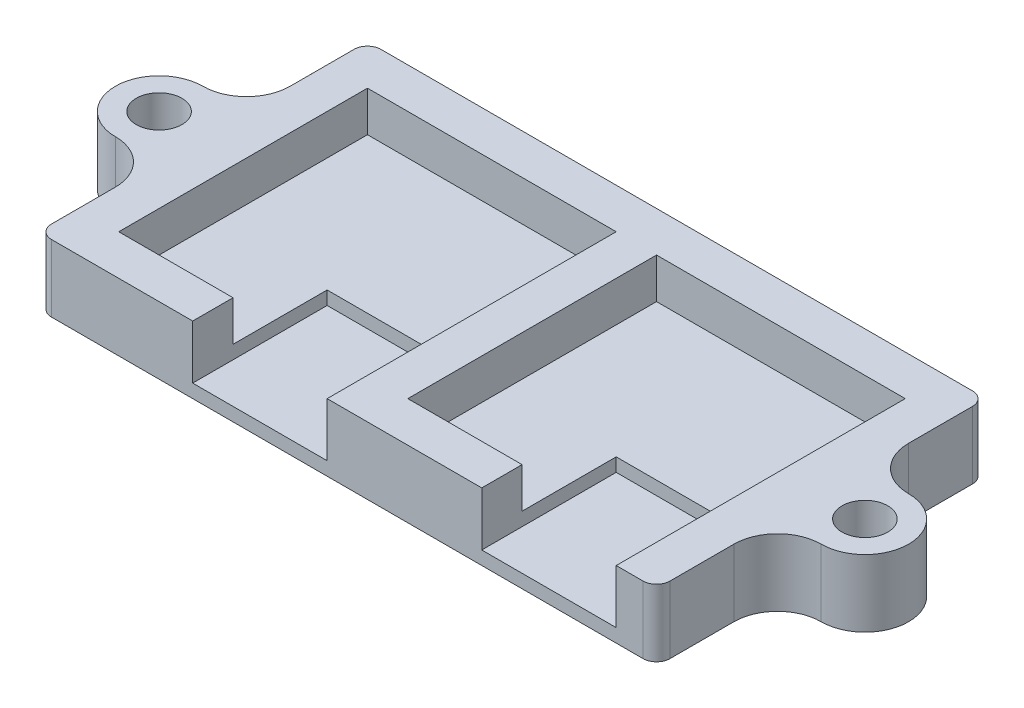
from build123d import *

# Parameters (mm, degrees)
SKETCH_1_R      = 1.7
SKETCH_1_W      = 10
SKETCH_1_H      = 3
SKETCH_1_H_2    = 7
EXTRUDE_1_DEPTH = 1
EXTRUDE_START   = 1
SKETCH_1_3_R    = 1.7
EXTRUDE_2_DEPTH = 1
EXTRUDE_START_2 = 2
SKETCH_1_5_R    = 1.7
EXTRUDE_3_DEPTH = 3
EXTRUDE_START_3 = 7
SKETCH_1_7_R    = 1.7
SKETCH_1_7_W    = 10
SKETCH_1_7_H    = 3
EXTRUDE_4_DEPTH = 2.5
EXTRUDE_START_4 = 9.5
SKETCH_1_9_W    = 10
SKETCH_1_9_H    = 7
SKETCH_1_9_H_2  = 3
SKETCH_1_9_R    = 1.7
EXTRUDE_5_DEPTH = 1
FILLET_1_R      = 1


with BuildPart() as part:
    # Эскиз1 → Бобышка-Вытянуть1 (new body)
    # profile 1 of 9: a face of its own
    with BuildSketch(Plane(origin=(0, 0, 0), x_dir=(1, 0, 0), z_dir=(0, 1, 0))):
        with BuildLine():
            ThreePointArc((-26.25, -3.25), (-23.951902961, -4.201902961), (-23, -6.5))
            Line((-23, -6.5), (-23, 6.5))
            ThreePointArc((-23, 6.5), (-23.951902961, 4.201902961), (-26.25, 3.25))
            ThreePointArc((-26.25, 3.25), (-29.5, 0), (-26.25, -3.25))
        make_face()
        with Locations(Location((-26.25, 0, 0), (0, 0, 270))):
            Circle(SKETCH_1_R, mode=Mode.SUBTRACT)
    # profile 2 of 9: a face of its own
    with BuildSketch(Plane(origin=(0, 0, 0), x_dir=(1, 0, 0), z_dir=(0, 1, 0))):
        with BuildLine():
            Line((20, -12.25), (22, -12.25))
            ThreePointArc((22, -12.25), (22.707106781, -11.957106781), (23, -11.25))
            Line((23, -11.25), (23, -6.5))
            Line((23, -6.5), (23, 6.5))
            Line((23, 6.5), (23, 11.25))
            ThreePointArc((23, 11.25), (22.707106781, 11.957106781), (22, 12.25))
            Line((22, 12.25), (-22, 12.25))
            ThreePointArc((-22, 12.25), (-22.707106781, 11.957106781), (-23, 11.25))
            Line((-23, 11.25), (-23, 6.5))
            Line((-23, 6.5), (-23, -6.5))
            Line((-23, -6.5), (-23, -11.25))
            ThreePointArc((-23, -11.25), (-22.707106781, -11.957106781), (-22, -12.25))
            Line((-22, -12.25), (-11.5, -12.25))
            Line((-11.5, -12.25), (-11.5, -9.25))
            Line((-11.5, -9.25), (-20, -9.25))
            Line((-20, -9.25), (-20, 9.25))
            Line((-20, 9.25), (-1.5, 9.25))
            Line((-1.5, 9.25), (-1.5, -2.25))
            Line((-1.5, -2.25), (-1.5, -9.25))
            Line((-1.5, -9.25), (-1.5, -12.25))
            Line((-1.5, -12.25), (10, -12.25))
            Line((10, -12.25), (10, -9.25))
            Line((10, -9.25), (1.5, -9.25))
            Line((1.5, -9.25), (1.5, 9.25))
            Line((1.5, 9.25), (20, 9.25))
            Line((20, 9.25), (20, -2.25))
            Line((20, -2.25), (20, -9.25))
            Line((20, -9.25), (20, -12.25))
        make_face()
    # profile 3 of 9: a face of its own
    with BuildSketch(Plane(origin=(0, 0, 0), x_dir=(1, 0, 0), z_dir=(0, 1, 0))):
        with Locations((-6.5, -10.75)):
            Rectangle(SKETCH_1_W, SKETCH_1_H)
    # profile 4 of 9: a face of its own
    with BuildSketch(Plane(origin=(0, 0, 0), x_dir=(1, 0, 0), z_dir=(0, 1, 0))):
        with Locations((-6.5, -5.75)):
            Rectangle(SKETCH_1_W, SKETCH_1_H_2)
    # profile 5 of 9: a face of its own
    with BuildSketch(Plane(origin=(0, 0, 0), x_dir=(1, 0, 0), z_dir=(0, 1, 0))):
        Polygon((-20, -9.25), (-11.5, -9.25), (-11.5, -2.25), (-1.5, -2.25), (-1.5, 9.25), (-20, 9.25), align=None)
    # profile 6 of 9: a face of its own
    with BuildSketch(Plane(origin=(0, 0, 0), x_dir=(1, 0, 0), z_dir=(0, 1, 0))):
        Polygon((1.5, -9.25), (10, -9.25), (10, -2.25), (20, -2.25), (20, 9.25), (1.5, 9.25), align=None)
    # profile 7 of 9: a face of its own
    with BuildSketch(Plane(origin=(0, 0, 0), x_dir=(1, 0, 0), z_dir=(0, 1, 0))):
        with Locations((15, -10.75)):
            Rectangle(SKETCH_1_W, SKETCH_1_H)
    # profile 8 of 9: a face of its own
    with BuildSketch(Plane(origin=(0, 0, 0), x_dir=(1, 0, 0), z_dir=(0, 1, 0))):
        with Locations((15, -5.75)):
            Rectangle(SKETCH_1_W, SKETCH_1_H_2)
    # profile 9 of 9: a face of its own
    with BuildSketch(Plane(origin=(0, 0, 0), x_dir=(1, 0, 0), z_dir=(0, 1, 0))):
        with BuildLine():
            Line((23, 6.5), (23, -6.5))
            ThreePointArc((23, -6.5), (23.951902961, -4.201902961), (26.25, -3.25))
            ThreePointArc((26.25, -3.25), (29.5, 0), (26.25, 3.25))
            ThreePointArc((26.25, 3.25), (23.951902961, 4.201902961), (23, 6.5))
        make_face()
        with Locations(Location((26.25, 0, 0), (0, 0, 270))):
            Circle(SKETCH_1_R, mode=Mode.SUBTRACT)
    extrude(amount=EXTRUDE_1_DEPTH)

    # Эскиз1<3> → Бобышка-Вытянуть2 (add)
    # profile 1 of 5: a face of its own
    with BuildSketch(Plane(origin=(0, 0, 0), x_dir=(1, 0, 0), z_dir=(0, 1, 0)).offset(EXTRUDE_START)):
        with BuildLine():
            Line((20, -12.25), (22, -12.25))
            ThreePointArc((22, -12.25), (22.707106781, -11.957106781), (23, -11.25))
            Line((23, -11.25), (23, -6.5))
            Line((23, -6.5), (23, 6.5))
            Line((23, 6.5), (23, 11.25))
            ThreePointArc((23, 11.25), (22.707106781, 11.957106781), (22, 12.25))
            Line((22, 12.25), (-22, 12.25))
            ThreePointArc((-22, 12.25), (-22.707106781, 11.957106781), (-23, 11.25))
            Line((-23, 11.25), (-23, 6.5))
            Line((-23, 6.5), (-23, -6.5))
            Line((-23, -6.5), (-23, -11.25))
            ThreePointArc((-23, -11.25), (-22.707106781, -11.957106781), (-22, -12.25))
            Line((-22, -12.25), (-11.5, -12.25))
            Line((-11.5, -12.25), (-11.5, -9.25))
            Line((-11.5, -9.25), (-20, -9.25))
            Line((-20, -9.25), (-20, 9.25))
            Line((-20, 9.25), (-1.5, 9.25))
            Line((-1.5, 9.25), (-1.5, -2.25))
            Line((-1.5, -2.25), (-1.5, -9.25))
            Line((-1.5, -9.25), (-1.5, -12.25))
            Line((-1.5, -12.25), (10, -12.25))
            Line((10, -12.25), (10, -9.25))
            Line((10, -9.25), (1.5, -9.25))
            Line((1.5, -9.25), (1.5, 9.25))
            Line((1.5, 9.25), (20, 9.25))
            Line((20, 9.25), (20, -2.25))
            Line((20, -2.25), (20, -9.25))
            Line((20, -9.25), (20, -12.25))
        make_face()
    # profile 2 of 5: a face of its own
    with BuildSketch(Plane(origin=(0, 0, 0), x_dir=(1, 0, 0), z_dir=(0, 1, 0)).offset(EXTRUDE_START)):
        Polygon((-20, -9.25), (-11.5, -9.25), (-11.5, -2.25), (-1.5, -2.25), (-1.5, 9.25), (-20, 9.25), align=None)
    # profile 3 of 5: a face of its own
    with BuildSketch(Plane(origin=(0, 0, 0), x_dir=(1, 0, 0), z_dir=(0, 1, 0)).offset(EXTRUDE_START)):
        with BuildLine():
            ThreePointArc((-26.25, -3.25), (-23.951902961, -4.201902961), (-23, -6.5))
            Line((-23, -6.5), (-23, 6.5))
            ThreePointArc((-23, 6.5), (-23.951902961, 4.201902961), (-26.25, 3.25))
            ThreePointArc((-26.25, 3.25), (-29.5, 0), (-26.25, -3.25))
        make_face()
        with Locations(Location((-26.25, 0, 0), (0, 0, 270))):
            Circle(SKETCH_1_3_R, mode=Mode.SUBTRACT)
    # profile 4 of 5: a face of its own
    with BuildSketch(Plane(origin=(0, 0, 0), x_dir=(1, 0, 0), z_dir=(0, 1, 0)).offset(EXTRUDE_START)):
        Polygon((1.5, -9.25), (10, -9.25), (10, -2.25), (20, -2.25), (20, 9.25), (1.5, 9.25), align=None)
    # profile 5 of 5: a face of its own
    with BuildSketch(Plane(origin=(0, 0, 0), x_dir=(1, 0, 0), z_dir=(0, 1, 0)).offset(EXTRUDE_START)):
        with BuildLine():
            Line((23, 6.5), (23, -6.5))
            ThreePointArc((23, -6.5), (23.951902961, -4.201902961), (26.25, -3.25))
            ThreePointArc((26.25, -3.25), (29.5, 0), (26.25, 3.25))
            ThreePointArc((26.25, 3.25), (23.951902961, 4.201902961), (23, 6.5))
        make_face()
        with Locations(Location((26.25, 0, 0), (0, 0, 270))):
            Circle(SKETCH_1_3_R, mode=Mode.SUBTRACT)
    extrude(amount=EXTRUDE_2_DEPTH)

    # Эскиз1<5> → Бобышка-Вытянуть3 (add)
    # profile 1 of 3: a face of its own
    with BuildSketch(Plane(origin=(0, 0, 0), x_dir=(1, 0, 0), z_dir=(0, 1, 0)).offset(EXTRUDE_START_2)):
        with BuildLine():
            Line((20, -12.25), (22, -12.25))
            ThreePointArc((22, -12.25), (22.707106781, -11.957106781), (23, -11.25))
            Line((23, -11.25), (23, -6.5))
            Line((23, -6.5), (23, 6.5))
            Line((23, 6.5), (23, 11.25))
            ThreePointArc((23, 11.25), (22.707106781, 11.957106781), (22, 12.25))
            Line((22, 12.25), (-22, 12.25))
            ThreePointArc((-22, 12.25), (-22.707106781, 11.957106781), (-23, 11.25))
            Line((-23, 11.25), (-23, 6.5))
            Line((-23, 6.5), (-23, -6.5))
            Line((-23, -6.5), (-23, -11.25))
            ThreePointArc((-23, -11.25), (-22.707106781, -11.957106781), (-22, -12.25))
            Line((-22, -12.25), (-11.5, -12.25))
            Line((-11.5, -12.25), (-11.5, -9.25))
            Line((-11.5, -9.25), (-20, -9.25))
            Line((-20, -9.25), (-20, 9.25))
            Line((-20, 9.25), (-1.5, 9.25))
            Line((-1.5, 9.25), (-1.5, -2.25))
            Line((-1.5, -2.25), (-1.5, -9.25))
            Line((-1.5, -9.25), (-1.5, -12.25))
            Line((-1.5, -12.25), (10, -12.25))
            Line((10, -12.25), (10, -9.25))
            Line((10, -9.25), (1.5, -9.25))
            Line((1.5, -9.25), (1.5, 9.25))
            Line((1.5, 9.25), (20, 9.25))
            Line((20, 9.25), (20, -2.25))
            Line((20, -2.25), (20, -9.25))
            Line((20, -9.25), (20, -12.25))
        make_face()
    # profile 2 of 3: a face of its own
    with BuildSketch(Plane(origin=(0, 0, 0), x_dir=(1, 0, 0), z_dir=(0, 1, 0)).offset(EXTRUDE_START_2)):
        with BuildLine():
            ThreePointArc((-26.25, -3.25), (-23.951902961, -4.201902961), (-23, -6.5))
            Line((-23, -6.5), (-23, 6.5))
            ThreePointArc((-23, 6.5), (-23.951902961, 4.201902961), (-26.25, 3.25))
            ThreePointArc((-26.25, 3.25), (-29.5, 0), (-26.25, -3.25))
        make_face()
        with Locations(Location((-26.25, 0, 0), (0, 0, 270))):
            Circle(SKETCH_1_5_R, mode=Mode.SUBTRACT)
    # profile 3 of 3: a face of its own
    with BuildSketch(Plane(origin=(0, 0, 0), x_dir=(1, 0, 0), z_dir=(0, 1, 0)).offset(EXTRUDE_START_2)):
        with BuildLine():
            Line((23, 6.5), (23, -6.5))
            ThreePointArc((23, -6.5), (23.951902961, -4.201902961), (26.25, -3.25))
            ThreePointArc((26.25, -3.25), (29.5, 0), (26.25, 3.25))
            ThreePointArc((26.25, 3.25), (23.951902961, 4.201902961), (23, 6.5))
        make_face()
        with Locations(Location((26.25, 0, 0), (0, 0, 270))):
            Circle(SKETCH_1_5_R, mode=Mode.SUBTRACT)
    extrude(amount=EXTRUDE_3_DEPTH)


with BuildPart() as body_2:
    # Эскиз1<7> → Бобышка-Вытянуть4 (new body)
    # profile 1 of 5: a face of its own
    with BuildSketch(Plane(origin=(0, 0, 0), x_dir=(1, 0, 0), z_dir=(0, 1, 0)).offset(EXTRUDE_START_3)):
        with BuildLine():
            Line((20, -12.25), (22, -12.25))
            ThreePointArc((22, -12.25), (22.707106781, -11.957106781), (23, -11.25))
            Line((23, -11.25), (23, -6.5))
            Line((23, -6.5), (23, 6.5))
            Line((23, 6.5), (23, 11.25))
            ThreePointArc((23, 11.25), (22.707106781, 11.957106781), (22, 12.25))
            Line((22, 12.25), (-22, 12.25))
            ThreePointArc((-22, 12.25), (-22.707106781, 11.957106781), (-23, 11.25))
            Line((-23, 11.25), (-23, 6.5))
            Line((-23, 6.5), (-23, -6.5))
            Line((-23, -6.5), (-23, -11.25))
            ThreePointArc((-23, -11.25), (-22.707106781, -11.957106781), (-22, -12.25))
            Line((-22, -12.25), (-11.5, -12.25))
            Line((-11.5, -12.25), (-11.5, -9.25))
            Line((-11.5, -9.25), (-20, -9.25))
            Line((-20, -9.25), (-20, 9.25))
            Line((-20, 9.25), (-1.5, 9.25))
            Line((-1.5, 9.25), (-1.5, -2.25))
            Line((-1.5, -2.25), (-1.5, -9.25))
            Line((-1.5, -9.25), (-1.5, -12.25))
            Line((-1.5, -12.25), (10, -12.25))
            Line((10, -12.25), (10, -9.25))
            Line((10, -9.25), (1.5, -9.25))
            Line((1.5, -9.25), (1.5, 9.25))
            Line((1.5, 9.25), (20, 9.25))
            Line((20, 9.25), (20, -2.25))
            Line((20, -2.25), (20, -9.25))
            Line((20, -9.25), (20, -12.25))
        make_face()
    # profile 2 of 5: a face of its own
    with BuildSketch(Plane(origin=(0, 0, 0), x_dir=(1, 0, 0), z_dir=(0, 1, 0)).offset(EXTRUDE_START_3)):
        with BuildLine():
            ThreePointArc((-26.25, -3.25), (-23.951902961, -4.201902961), (-23, -6.5))
            Line((-23, -6.5), (-23, 6.5))
            ThreePointArc((-23, 6.5), (-23.951902961, 4.201902961), (-26.25, 3.25))
            ThreePointArc((-26.25, 3.25), (-29.5, 0), (-26.25, -3.25))
        make_face()
        with Locations(Location((-26.25, 0, 0), (0, 0, 270))):
            Circle(SKETCH_1_7_R, mode=Mode.SUBTRACT)
    # profile 3 of 5: a face of its own
    with BuildSketch(Plane(origin=(0, 0, 0), x_dir=(1, 0, 0), z_dir=(0, 1, 0)).offset(EXTRUDE_START_3)):
        with BuildLine():
            Line((23, 6.5), (23, -6.5))
            ThreePointArc((23, -6.5), (23.951902961, -4.201902961), (26.25, -3.25))
            ThreePointArc((26.25, -3.25), (29.5, 0), (26.25, 3.25))
            ThreePointArc((26.25, 3.25), (23.951902961, 4.201902961), (23, 6.5))
        make_face()
        with Locations(Location((26.25, 0, 0), (0, 0, 270))):
            Circle(SKETCH_1_7_R, mode=Mode.SUBTRACT)
    # profile 4 of 5: a face of its own
    with BuildSketch(Plane(origin=(0, 0, 0), x_dir=(1, 0, 0), z_dir=(0, 1, 0)).offset(EXTRUDE_START_3)):
        with Locations((-6.5, -10.75)):
            Rectangle(SKETCH_1_7_W, SKETCH_1_7_H)
    # profile 5 of 5: a face of its own
    with BuildSketch(Plane(origin=(0, 0, 0), x_dir=(1, 0, 0), z_dir=(0, 1, 0)).offset(EXTRUDE_START_3)):
        with Locations((15, -10.75)):
            Rectangle(SKETCH_1_7_W, SKETCH_1_7_H)
    extrude(amount=EXTRUDE_4_DEPTH)

    # Эскиз1<9> → Бобышка-Вытянуть5 (add)
    # profile 1 of 9: a face of its own
    with BuildSketch(Plane(origin=(0, 0, 0), x_dir=(1, 0, 0), z_dir=(0, 1, 0)).offset(EXTRUDE_START_4)):
        Polygon((-20, -9.25), (-11.5, -9.25), (-11.5, -2.25), (-1.5, -2.25), (-1.5, 9.25), (-20, 9.25), align=None)
    # profile 2 of 9: a face of its own
    with BuildSketch(Plane(origin=(0, 0, 0), x_dir=(1, 0, 0), z_dir=(0, 1, 0)).offset(EXTRUDE_START_4)):
        Polygon((1.5, -9.25), (10, -9.25), (10, -2.25), (20, -2.25), (20, 9.25), (1.5, 9.25), align=None)
    # profile 3 of 9: a face of its own
    with BuildSketch(Plane(origin=(0, 0, 0), x_dir=(1, 0, 0), z_dir=(0, 1, 0)).offset(EXTRUDE_START_4)):
        with Locations((15, -5.75)):
            Rectangle(SKETCH_1_9_W, SKETCH_1_9_H)
    # profile 4 of 9: a face of its own
    with BuildSketch(Plane(origin=(0, 0, 0), x_dir=(1, 0, 0), z_dir=(0, 1, 0)).offset(EXTRUDE_START_4)):
        with Locations((15, -10.75)):
            Rectangle(SKETCH_1_9_W, SKETCH_1_9_H_2)
    # profile 5 of 9: a face of its own
    with BuildSketch(Plane(origin=(0, 0, 0), x_dir=(1, 0, 0), z_dir=(0, 1, 0)).offset(EXTRUDE_START_4)):
        with Locations((-6.5, -10.75)):
            Rectangle(SKETCH_1_9_W, SKETCH_1_9_H_2)
    # profile 6 of 9: a face of its own
    with BuildSketch(Plane(origin=(0, 0, 0), x_dir=(1, 0, 0), z_dir=(0, 1, 0)).offset(EXTRUDE_START_4)):
        with Locations((-6.5, -5.75)):
            Rectangle(SKETCH_1_9_W, SKETCH_1_9_H)
    # profile 7 of 9: a face of its own
    with BuildSketch(Plane(origin=(0, 0, 0), x_dir=(1, 0, 0), z_dir=(0, 1, 0)).offset(EXTRUDE_START_4)):
        with BuildLine():
            Line((20, -12.25), (22, -12.25))
            ThreePointArc((22, -12.25), (22.707106781, -11.957106781), (23, -11.25))
            Line((23, -11.25), (23, -6.5))
            Line((23, -6.5), (23, 6.5))
            Line((23, 6.5), (23, 11.25))
            ThreePointArc((23, 11.25), (22.707106781, 11.957106781), (22, 12.25))
            Line((22, 12.25), (-22, 12.25))
            ThreePointArc((-22, 12.25), (-22.707106781, 11.957106781), (-23, 11.25))
            Line((-23, 11.25), (-23, 6.5))
            Line((-23, 6.5), (-23, -6.5))
            Line((-23, -6.5), (-23, -11.25))
            ThreePointArc((-23, -11.25), (-22.707106781, -11.957106781), (-22, -12.25))
            Line((-22, -12.25), (-11.5, -12.25))
            Line((-11.5, -12.25), (-11.5, -9.25))
            Line((-11.5, -9.25), (-20, -9.25))
            Line((-20, -9.25), (-20, 9.25))
            Line((-20, 9.25), (-1.5, 9.25))
            Line((-1.5, 9.25), (-1.5, -2.25))
            Line((-1.5, -2.25), (-1.5, -9.25))
            Line((-1.5, -9.25), (-1.5, -12.25))
            Line((-1.5, -12.25), (10, -12.25))
            Line((10, -12.25), (10, -9.25))
            Line((10, -9.25), (1.5, -9.25))
            Line((1.5, -9.25), (1.5, 9.25))
            Line((1.5, 9.25), (20, 9.25))
            Line((20, 9.25), (20, -2.25))
            Line((20, -2.25), (20, -9.25))
            Line((20, -9.25), (20, -12.25))
        make_face()
    # profile 8 of 9: a face of its own
    with BuildSketch(Plane(origin=(0, 0, 0), x_dir=(1, 0, 0), z_dir=(0, 1, 0)).offset(EXTRUDE_START_4)):
        with BuildLine():
            Line((23, 6.5), (23, -6.5))
            ThreePointArc((23, -6.5), (23.951902961, -4.201902961), (26.25, -3.25))
            ThreePointArc((26.25, -3.25), (29.5, 0), (26.25, 3.25))
            ThreePointArc((26.25, 3.25), (23.951902961, 4.201902961), (23, 6.5))
        make_face()
        with Locations(Location((26.25, 0, 0), (0, 0, 270))):
            Circle(SKETCH_1_9_R, mode=Mode.SUBTRACT)
    # profile 9 of 9: a face of its own
    with BuildSketch(Plane(origin=(0, 0, 0), x_dir=(1, 0, 0), z_dir=(0, 1, 0)).offset(EXTRUDE_START_4)):
        with BuildLine():
            ThreePointArc((-26.25, -3.25), (-23.951902961, -4.201902961), (-23, -6.5))
            Line((-23, -6.5), (-23, 6.5))
            ThreePointArc((-23, 6.5), (-23.951902961, 4.201902961), (-26.25, 3.25))
            ThreePointArc((-26.25, 3.25), (-29.5, 0), (-26.25, -3.25))
        make_face()
        with Locations(Location((-26.25, 0, 0), (0, 0, 270))):
            Circle(SKETCH_1_9_R, mode=Mode.SUBTRACT)
    extrude(amount=EXTRUDE_5_DEPTH)

    # Скругление1
    fillet_1_edges = [body_2.edges().sort_by_distance(p)[0] for p in [
        (-22.707106781, 10.5, -11.957106781),
        (-23, 10.5, -8.875),
        (-29.5, 10.5, 0),
        (-23, 10.5, 8.875),
        (-22.707106781, 10.5, 11.957106781),
        (0, 10.5, 12.25),
        (22.707106781, 10.5, 11.957106781),
        (29.5, 10.5, 0),
        (22.707106781, 10.5, -11.957106781),
        (0, 10.5, -12.25),
        (-23.951902961, 10.5, -4.201902961),
        (-23.951902961, 10.5, 4.201902961),
        (23, 10.5, 8.875),
        (23.951902961, 10.5, 4.201902961),
        (23.951902961, 10.5, -4.201902961),
        (23, 10.5, -8.875),
    ]]
    fillet(fillet_1_edges, radius=FILLET_1_R)


solid = part.part
